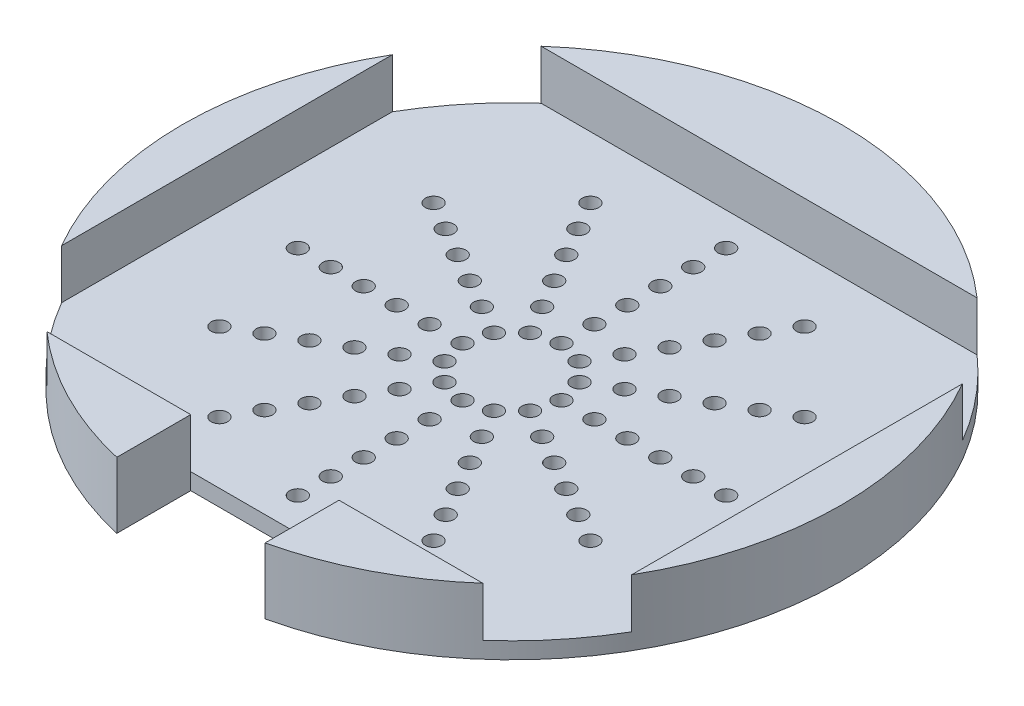
from build123d import *

# Parameters (mm, degrees)
SKETCH_1_R               = 100
EXTRUDE_1_DEPTH          = 20
SKETCH_2_W               = 173
SKETCH_2_H               = 150
CUT_EXTRUDE_1_DEPTH      = 15
SKETCH_3_R               = 2.5
CUT_EXTRUDE_2_DEPTH      = 143.214626533
PATTERN_CIRCULAR_2_COUNT = 12
SKETCH_4_W               = 45
SKETCH_4_H               = 25
CUT_EXTRUDE_3_DEPTH      = 143.828568571


with BuildPart() as part:
    # 草圖1 → 填料-伸長1 (new body)
    with BuildSketch(Plane(origin=(0, 0, 0), x_dir=(1, 0, 0), z_dir=(0, 1, 0))):
        Circle(SKETCH_1_R)
    extrude(amount=EXTRUDE_1_DEPTH)

    # 草圖2 → 除料-伸長1 (cut)
    with BuildSketch(Plane(origin=(0, 20, 0), x_dir=(1, 0, 0), z_dir=(0, 1, 0))):
        Rectangle(SKETCH_2_W, SKETCH_2_H)
    extrude(amount=-CUT_EXTRUDE_1_DEPTH, mode=Mode.SUBTRACT)

    # 草圖3 → 除料-伸長2 (cut, through all)
    with BuildSketch(Plane(origin=(0, 5, 0), x_dir=(1, 0, 0), z_dir=(0, 1, 0))):
        with Locations((0, 65)):
            Circle(SKETCH_3_R)
        with Locations((0, 55)):
            Circle(SKETCH_3_R)
        with Locations((0, 45)):
            Circle(SKETCH_3_R)
        with Locations((0, 35)):
            Circle(SKETCH_3_R)
        with Locations((0, 25)):
            Circle(SKETCH_3_R)
        with Locations((0, 15)):
            Circle(SKETCH_3_R)
    cut_extrude_2 = extrude(amount=-CUT_EXTRUDE_2_DEPTH, mode=Mode.SUBTRACT)

    # 環狀複製排列2: 除料-伸長2 ×12 about axis
    pattern_circular_2_axis = Axis((0, 20, 0), (0, -1, 0))
    for i in range(1, PATTERN_CIRCULAR_2_COUNT):
        add(cut_extrude_2.rotate(pattern_circular_2_axis, i * 360 / PATTERN_CIRCULAR_2_COUNT), mode=Mode.SUBTRACT)

    # 草圖4 → 除料-伸長3 (cut, through all)
    with BuildSketch(Plane(origin=(0, 20, 0), x_dir=(1, 0, 0), z_dir=(0, 1, 0))):
        with Locations((0, -87.5)):
            Rectangle(SKETCH_4_W, SKETCH_4_H)
    extrude(amount=-CUT_EXTRUDE_3_DEPTH, mode=Mode.SUBTRACT)


solid = part.part
